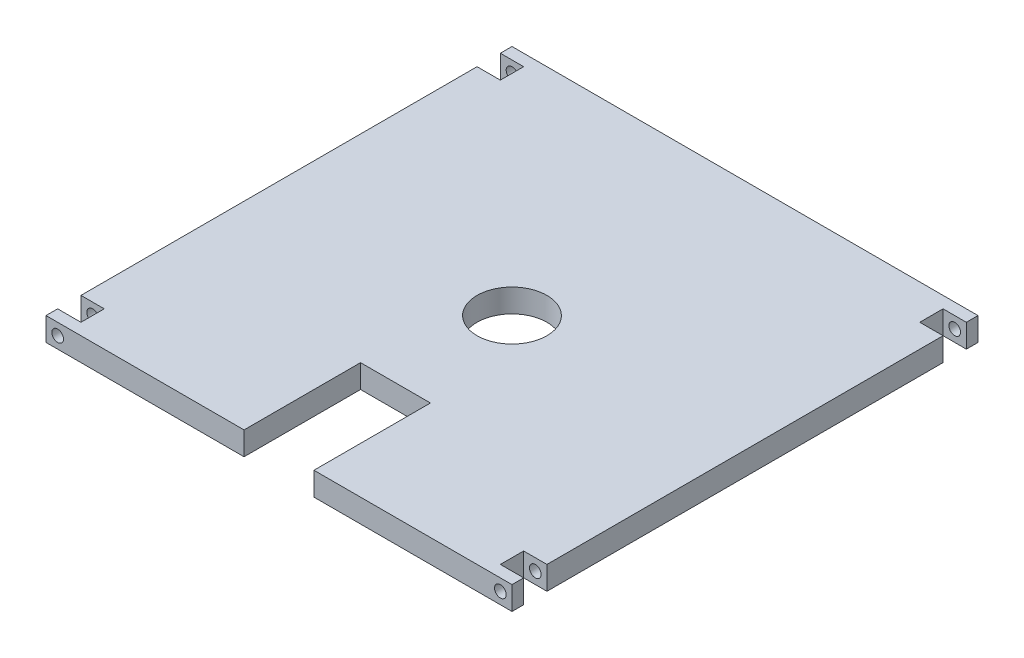
from build123d import *

# Parameters (mm, degrees)
ESQUISSE1_R             = 15
BASE_DEPTH              = 10
ESQUISSE2_R             = 2.5
ENL_V_MAT_EXTRU_1_DEPTH = 224.830292856


with BuildPart() as part:
    # Esquisse1 → BASE (new body)
    with BuildSketch(Plane(origin=(0, 0, 0), x_dir=(1, 0, 0), z_dir=(0, 1, 0))):
        Polygon((-100, 95), (-90, 95), (-90, 85), (-100, 85), (-100, -85), (-90, -85), (-90, -95), (-100, -95), (-100, -100), (-15, -100), (-15, -50), (15, -50), (15, -100), (100, -100), (100, -95), (90, -95), (90, -85), (100, -85), (100, 85), (90, 85), (90, 95), (100, 95), (100, 100), (-100, 100), align=None)
        with Locations(Location((0, 0, 0), (0, 0, 270))):
            Circle(ESQUISSE1_R, mode=Mode.SUBTRACT)
    extrude(amount=BASE_DEPTH)

    # Esquisse2 → Enlèv. mat.-Extru.1 (cut, through all)
    with BuildSketch(Plane.XY.offset(100)):
        with Locations((-95, 5)):
            Circle(ESQUISSE2_R)
        with Locations(Location((95, 5, 0), (0, 0, 180))):
            Circle(ESQUISSE2_R)
    extrude(amount=-ENL_V_MAT_EXTRU_1_DEPTH, mode=Mode.SUBTRACT)


solid = part.part
